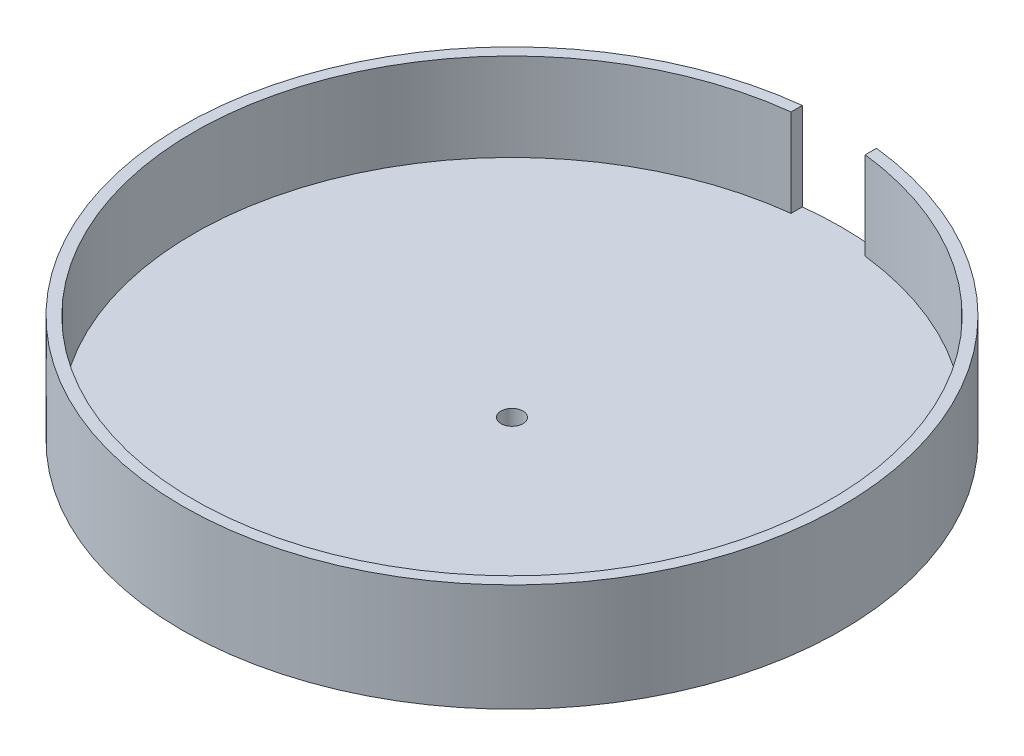
from build123d import *

# Parameters (mm, degrees)
SKETCH2_R           = 150
SKETCH2_R_2         = 5
BOSS_EXTRUDE1_DEPTH = 9
SKETCH3_R           = 150
BOSS_EXTRUDE2_DEPTH = 40
SKETCH9_R           = 144.906998713
CUT_EXTRUDE2_DEPTH  = 40
SKETCH11_W          = 33.774160464
SKETCH11_H          = 12.160705968
CUT_EXTRUDE9_DEPTH  = 40


with BuildPart() as part:
    # Sketch2 → Boss-Extrude1 (new body)
    with BuildSketch(Plane(origin=(0, 0, 0), x_dir=(1, 0, 0), z_dir=(0, 1, 0))):
        with Locations(Location((0, 0, 0), (0, 0, 270))):
            Circle(SKETCH2_R)
        with Locations(Location((0, 0, 0), (0, 0, 270))):
            Circle(SKETCH2_R_2, mode=Mode.SUBTRACT)
    extrude(amount=BOSS_EXTRUDE1_DEPTH)

    # Sketch3 → Boss-Extrude2 (add)
    with BuildSketch(Plane(origin=(0, 9, 0), x_dir=(1, 0, 0), z_dir=(0, 1, 0))):
        with Locations(Location((0, 0, 0), (0, 0, 270))):
            Circle(SKETCH3_R)
    extrude(amount=BOSS_EXTRUDE2_DEPTH)

    # Sketch9 → Cut-Extrude2 (cut)
    with BuildSketch(Plane(origin=(0, 49, 0), x_dir=(1, 0, 0), z_dir=(0, 1, 0))):
        with Locations(Location((0, 0, 0), (0, 0, 270))):
            Circle(SKETCH9_R)
    extrude(amount=-CUT_EXTRUDE2_DEPTH, mode=Mode.SUBTRACT)

    # Sketch11 → Cut-Extrude9 (cut)
    with BuildSketch(Plane(origin=(0, 49, 0), x_dir=(1, 0, 0), z_dir=(0, 1, 0))):
        with Locations((0, 150)):
            Rectangle(SKETCH11_W, SKETCH11_H)
    extrude(amount=-CUT_EXTRUDE9_DEPTH, mode=Mode.SUBTRACT)


solid = part.part
